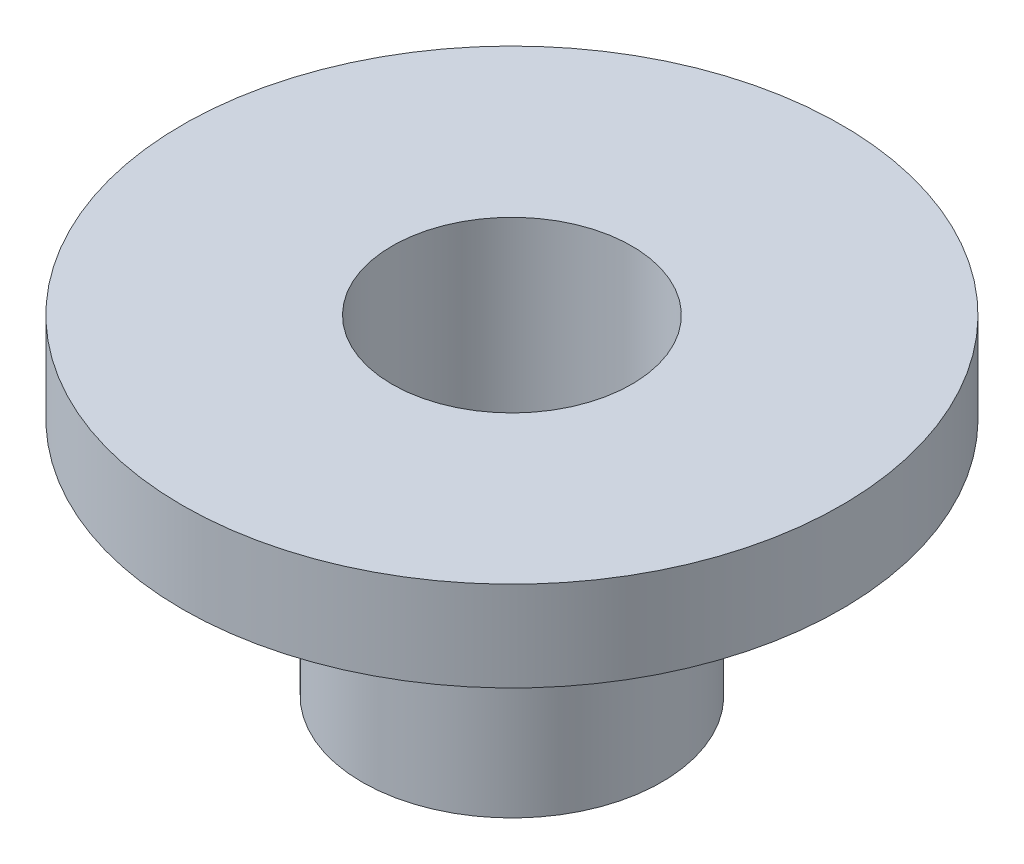
from build123d import *

# Parameters (mm, degrees)
SKICA1_R                = 5
SKICA1_R_2              = 4
P_IDAT_VYSUNUT_M1_DEPTH = 8
SKICA2_R                = 11
SKICA2_R_2              = 4
P_IDAT_VYSUNUT_M2_DEPTH = 3


with BuildPart() as part:
    # Skica1 → Přidat vysunutím1 (new body)
    with BuildSketch(Plane(origin=(0, 0, 0), x_dir=(1, 0, 0), z_dir=(0, 1, 0))):
        with Locations(Location((0, 0, 0), (0, 0, 270))):
            Circle(SKICA1_R)
        with Locations(Location((0, 0, 0), (0, 0, 270))):
            Circle(SKICA1_R_2, mode=Mode.SUBTRACT)
    extrude(amount=P_IDAT_VYSUNUT_M1_DEPTH)

    # Skica2 → Přidat vysunutím2 (add)
    with BuildSketch(Plane(origin=(0, 8, 0), x_dir=(1, 0, 0), z_dir=(0, 1, 0))):
        with Locations(Location((0, 0, 0), (0, 0, 270))):
            Circle(SKICA2_R)
        with Locations(Location((0, 0, 0), (0, 0, 270))):
            Circle(SKICA2_R_2, mode=Mode.SUBTRACT)
    extrude(amount=P_IDAT_VYSUNUT_M2_DEPTH)


solid = part.part
